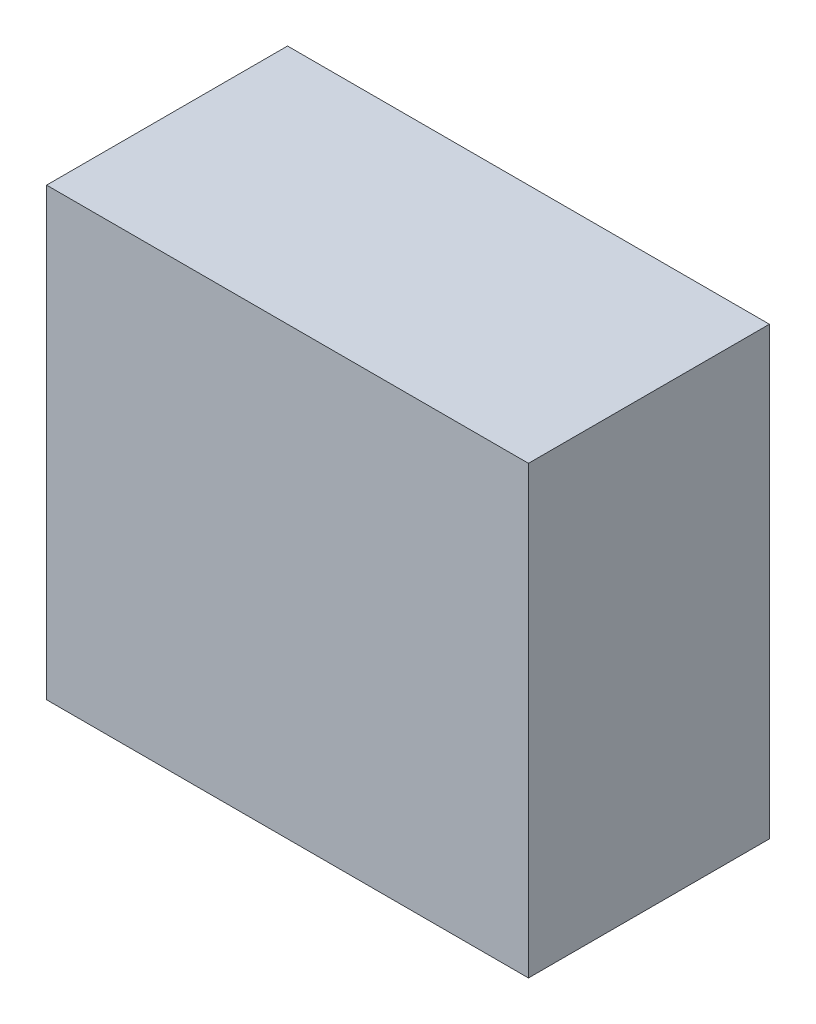
from build123d import *

# Parameters (mm, degrees)
ESQUISSE1_W        = 20
ESQUISSE1_H        = 18.5
BOSS_EXTRU_1_DEPTH = 10


with BuildPart() as part:
    # Esquisse1 → Boss.-Extru.1 (new body)
    with BuildSketch(Plane.XY):
        with Locations((10, 9.25)):
            Rectangle(ESQUISSE1_W, ESQUISSE1_H)
    extrude(amount=BOSS_EXTRU_1_DEPTH)


solid = part.part
